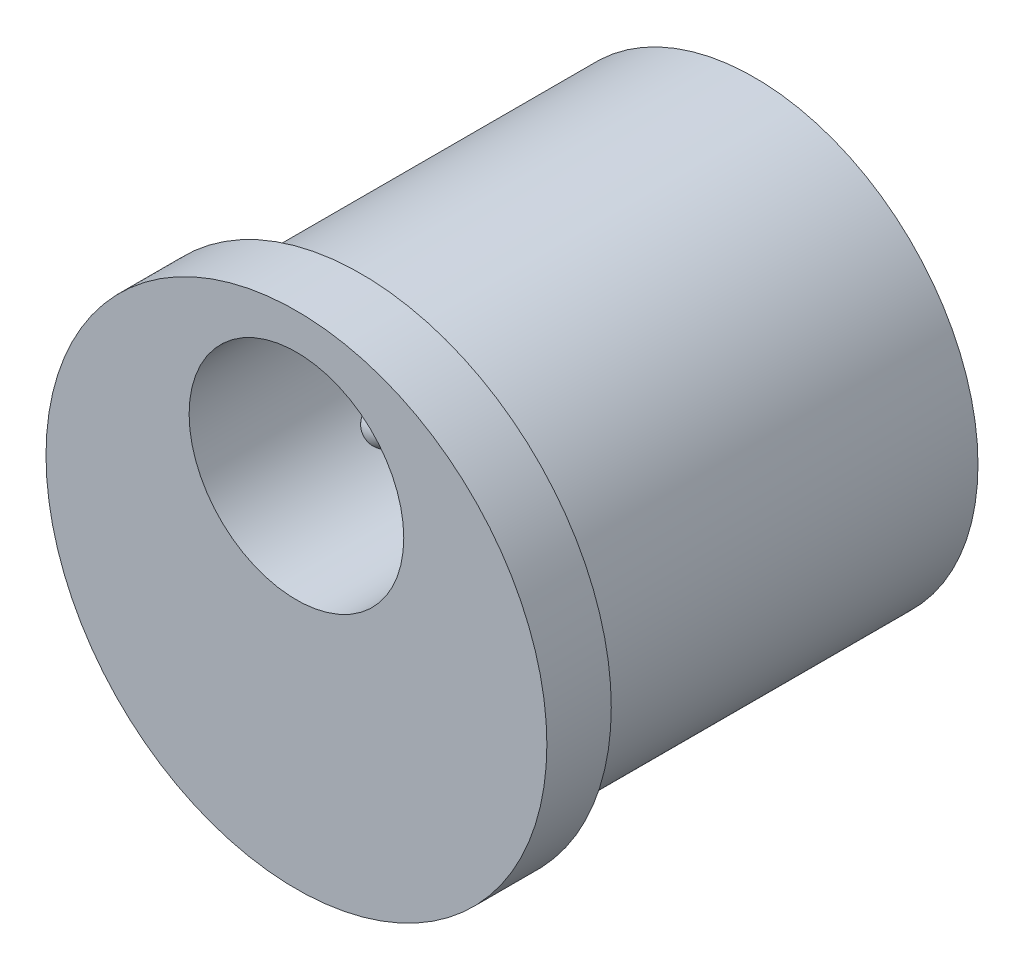
from build123d import *

# Parameters (mm, degrees)
ESBO_O1_R                = 7
ESBO_O1_R_2              = 3
RESSALTO_EXTRUS_O1_DEPTH = 1.8
ESBO_O2_R                = 6.25
RESSALTO_EXTRUS_O2_DEPTH = 11
CORTE_EXTRUS_O1_START    = -11
ESBO_O3_R                = 3
CORTE_EXTRUS_O1_DEPTH    = 11
ESBO_O4_R                = 0.5
RESSALTO_EXTRUS_O3_DEPTH = 9
FILETE1_R                = 0.5
ESBO_O5_W                = 4
ESBO_O5_H                = 0.265788673
ESBO_O5_W_2              = 0.206724524
ESBO_O5_H_2              = 4
RESSALTO_EXTRUS_O4_DEPTH = 4.5
CORTE_EXTRUS_O2_DEPTH    = 2.25
CORTE_EXTRUS_O3_DEPTH    = 2.25


with BuildPart() as part:
    # Esboço1 → Ressalto-extrusão1 (new body)
    with BuildSketch(Plane.XY):
        Circle(ESBO_O1_R)
        with Locations((0, 3)):
            Circle(ESBO_O1_R_2, mode=Mode.SUBTRACT)
    extrude(amount=RESSALTO_EXTRUS_O1_DEPTH)

    # Esboço2 → Ressalto-extrusão2 (add)
    with BuildSketch(Plane(origin=(0, 0, 0), x_dir=(-1, 0, 0), z_dir=(0, 0, -1))):
        with Locations(Location((0, 0, 0), (0, 0, 180))):
            Circle(ESBO_O2_R)
    extrude(amount=RESSALTO_EXTRUS_O2_DEPTH)

    # Esboço3 → Corte-extrusão1 (cut)
    with BuildSketch(Plane.XY.offset(1.8).offset(CORTE_EXTRUS_O1_START)):
        with Locations((0, 3)):
            Circle(ESBO_O3_R)
    extrude(amount=CORTE_EXTRUS_O1_DEPTH, mode=Mode.SUBTRACT)

    # Esboço4 → Ressalto-extrusão3 (add)
    with BuildSketch(Plane.XY.offset(-9.2)):
        with Locations((0, 3)):
            Circle(ESBO_O4_R)
    extrude(amount=RESSALTO_EXTRUS_O3_DEPTH)

    # Filete1
    filete1_edges = [part.edges().sort_by_distance(p)[0] for p in [
        (-0.5, 3, -0.2),
    ]]
    fillet(filete1_edges, radius=FILETE1_R)

    # Esboço5 → Ressalto-extrusão4 (add)
    with BuildSketch(Plane(origin=(0, 0, -11), x_dir=(-1, 0, 0), z_dir=(0, 0, -1))):
        with Locations((0.095181179, -5.212411193)):
            Rectangle(ESBO_O5_W, ESBO_O5_H)
        with Locations((5.289644951, -0.001979347)):
            Rectangle(ESBO_O5_W_2, ESBO_O5_H_2)
    extrude(amount=RESSALTO_EXTRUS_O4_DEPTH)

    # Esboço6 → Corte-extrusão2 (cut, symmetric)
    with BuildSketch(Plane.ZY.offset(5.393007213)):
        with BuildLine():
            Line((-15.5, -2.001979347), (-14, -2.001979347))
            ThreePointArc((-14, -2.001979347), (-15.060660172, -1.562639519), (-15.5, -0.501979347))
            Line((-15.5, -0.501979347), (-15.5, -2.001979347))
        make_face()
        with BuildLine():
            Line((-15.5, 1.998020653), (-15.5, 0.498020653))
            ThreePointArc((-15.5, 0.498020653), (-15.060660172, 1.558680825), (-14, 1.998020653))
            Line((-14, 1.998020653), (-15.5, 1.998020653))
        make_face()
    extrude(amount=CORTE_EXTRUS_O2_DEPTH, both=True, mode=Mode.SUBTRACT)

    # Esboço7 → Corte-extrusão3 (cut, symmetric)
    with BuildSketch(Plane.XZ.offset(5.345305529)):
        with BuildLine():
            Line((1.904818821, -15.5), (1.904818821, -14))
            ThreePointArc((1.904818821, -14), (1.465478993, -15.060660172), (0.404818821, -15.5))
            Line((0.404818821, -15.5), (1.904818821, -15.5))
        make_face()
        with BuildLine():
            Line((-2.095181179, -15.5), (-0.595181179, -15.5))
            ThreePointArc((-0.595181179, -15.5), (-1.655841351, -15.060660172), (-2.095181179, -14))
            Line((-2.095181179, -14), (-2.095181179, -15.5))
        make_face()
    extrude(amount=CORTE_EXTRUS_O3_DEPTH, both=True, mode=Mode.SUBTRACT)


solid = part.part
